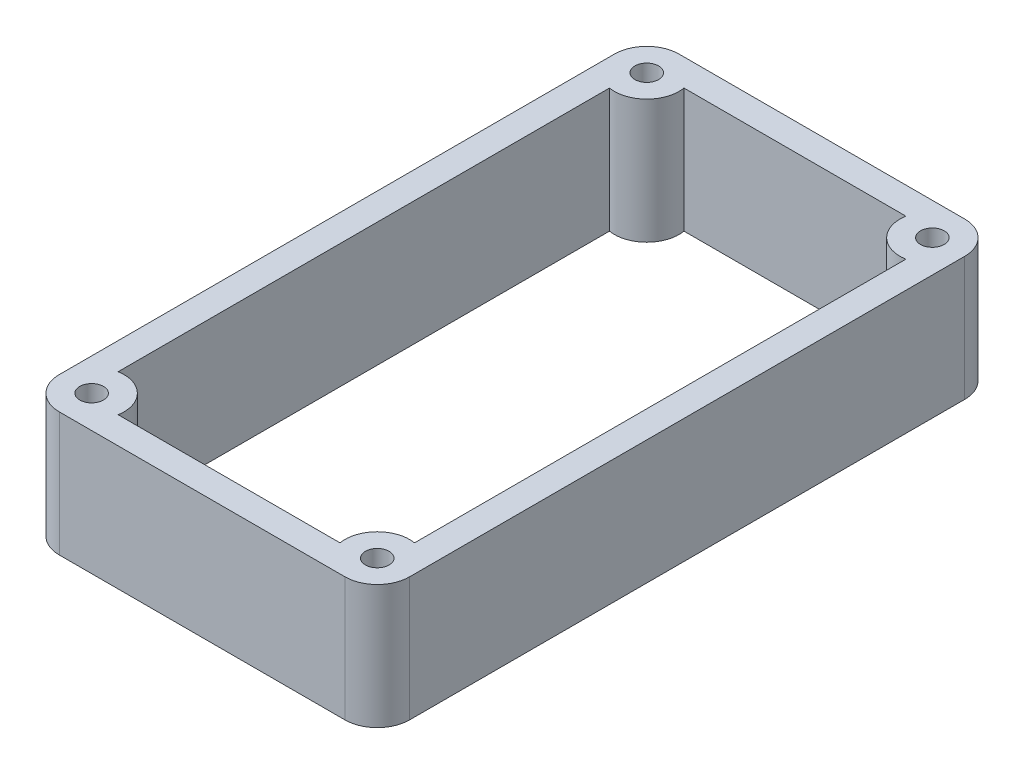
from build123d import *

# Parameters (mm, degrees)
SKETCH1_W           = 65
SKETCH1_H           = 115
SKETCH1_W_2         = 55
SKETCH1_H_2         = 105
BOSS_EXTRUDE1_DEPTH = 23
FILLET1_R           = 6
SKETCH2_R           = 6
BOSS_EXTRUDE2_DEPTH = 23
SKETCH4_R           = 2.2
CUT_EXTRUDE1_DEPTH  = 23


with BuildPart() as part:
    # Sketch1 → Boss-Extrude1 (new body)
    with BuildSketch(Plane(origin=(0, 0, 0), x_dir=(1, 0, 0), z_dir=(0, 1, 0))):
        Rectangle(SKETCH1_W, SKETCH1_H)
        Rectangle(SKETCH1_W_2, SKETCH1_H_2, mode=Mode.SUBTRACT)
    extrude(amount=BOSS_EXTRUDE1_DEPTH)

    # Fillet1
    fillet1_edges = [part.edges().sort_by_distance(p)[0] for p in [
        (32.5, 11.5, 57.5),
        (-32.5, 11.5, 57.5),
        (-32.5, 11.5, -57.5),
        (32.5, 11.5, -57.5),
    ]]
    fillet(fillet1_edges, radius=FILLET1_R)

    # Sketch2 → Boss-Extrude2 (add)
    with BuildSketch(Plane(origin=(0, 23, 0), x_dir=(1, 0, 0), z_dir=(0, 1, 0))):
        with Locations((-26.5, 51.5)):
            Circle(SKETCH2_R)
        with Locations((26.5, 51.5)):
            Circle(SKETCH2_R)
        with Locations((-26.5, -51.5)):
            Circle(SKETCH2_R)
        with Locations((26.5, -51.5)):
            Circle(SKETCH2_R)
    extrude(amount=-BOSS_EXTRUDE2_DEPTH)

    # Sketch4 → Cut-Extrude1 (cut)
    with BuildSketch(Plane(origin=(0, 23, 0), x_dir=(1, 0, 0), z_dir=(0, 1, 0))):
        with Locations(Location((-26.5, 51.5, 0), (0, 0, 270))):
            Circle(SKETCH4_R)
        with Locations(Location((26.5, 51.5, 0), (0, 0, 270))):
            Circle(SKETCH4_R)
        with Locations(Location((26.5, -51.5, 0), (0, 0, 270))):
            Circle(SKETCH4_R)
        with Locations(Location((-26.5, -51.5, 0), (0, 0, 270))):
            Circle(SKETCH4_R)
    extrude(amount=-CUT_EXTRUDE1_DEPTH, mode=Mode.SUBTRACT)


solid = part.part
